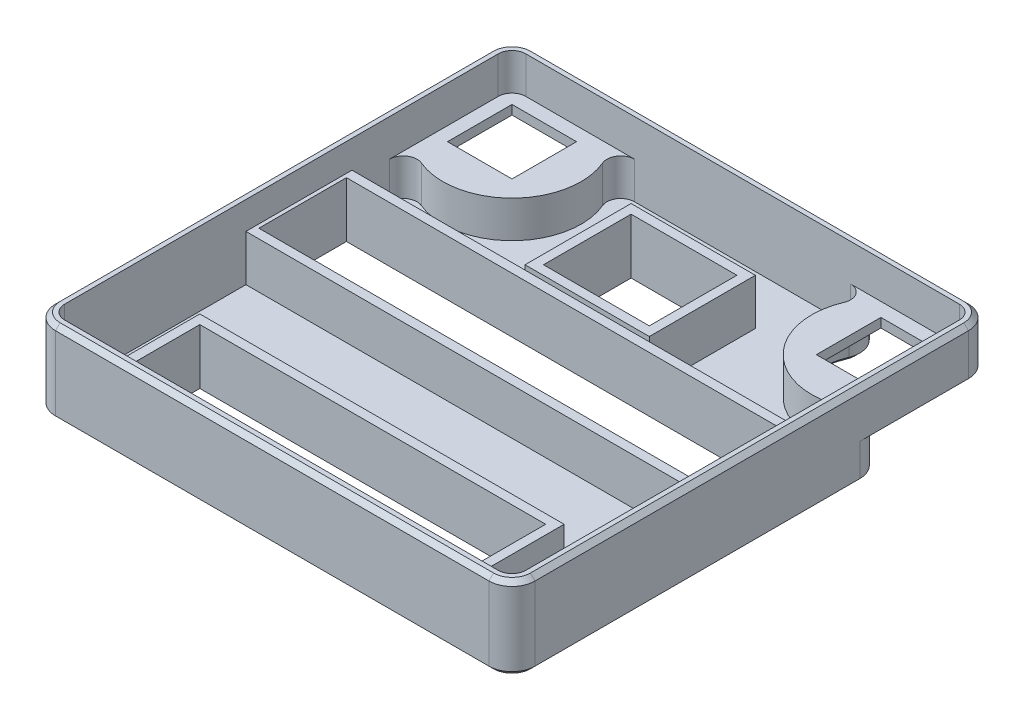
from build123d import *

# Parameters (mm, degrees)
SKETCH_1_W          = 22.95
SKETCH_1_H          = 19
SKETCH_1_W_2        = 75
SKETCH_1_W_3        = 98.4
EXTRUDE_7_DEPTH     = 2
SKETCH_4_R          = 15
CUT_EXTRUDE_1_DEPTH = 18
FILLET_1_R          = 3
FILLET_2_R          = 3
SKETCH_1_6_W        = 26.95
SKETCH_1_6_H        = 23
SKETCH_1_6_W_2      = 22.95
SKETCH_1_6_H_2      = 19
EXTRUDE_3_DEPTH     = 12
SKETCH_1_7_W        = 102.4
SKETCH_1_7_H        = 23
SKETCH_1_7_W_2      = 98.4
SKETCH_1_7_H_2      = 19
EXTRUDE_4_DEPTH     = 12
SKETCH_1_8_W        = 79
SKETCH_1_8_H        = 23
SKETCH_1_8_W_2      = 75
SKETCH_1_8_H_2      = 19
EXTRUDE_5_DEPTH     = 12
EXTRUDE_START       = 16
EXTRUDE_7_2_DEPTH   = 18
SKETCH_11_W         = 28.583123952
SKETCH_11_H         = 28.583123952
CUT_EXTRUDE_8_DEPTH = 10
EXTRUDE_START_2     = 2
SKETCH_13_W         = 14
SKETCH_13_H         = 14
EXTRUDE_8_DEPTH     = 2
SKETCH_15_W         = 14
SKETCH_15_H         = 14
EXTRUDE_9_DEPTH     = 2
EXTRUDE_START_3     = 8
EXTRUDE_12_DEPTH    = 8
CHAMFER_1_SIZE      = 1
CHAMFER_2_SIZE      = 1


with BuildPart() as part:
    # 草图1 → Extrude 7 (new body)
    with BuildSketch(Plane(origin=(0, 0, 0), x_dir=(1, 0, 0), z_dir=(0, 1, 0))):
        with BuildLine():
            Line((3, 0), (97, 0))
            ThreePointArc((97, 0), (99.121320344, 0.878679656), (100, 3))
            Line((100, 3), (100, 97))
            ThreePointArc((100, 97), (99.121320344, 99.121320344), (97, 100))
            Line((97, 100), (3, 100))
            ThreePointArc((3, 100), (0.878679656, 99.121320344), (0, 97))
            Line((0, 97), (0, 3))
            ThreePointArc((0, 3), (0.878679656, 0.878679656), (3, 0))
        make_face()
        with Locations((50, 77.8)):
            Rectangle(SKETCH_1_W, SKETCH_1_H, mode=Mode.SUBTRACT)
        with Locations((50, 10.3)):
            Rectangle(SKETCH_1_W_2, SKETCH_1_H, mode=Mode.SUBTRACT)
        with Locations((50, 53.8)):
            Rectangle(SKETCH_1_W_3, SKETCH_1_H, mode=Mode.SUBTRACT)
    extrude(amount=EXTRUDE_7_DEPTH)

    # 草图4 → 切除-拉伸1 (cut)
    with BuildSketch(Plane(origin=(0, 2, 0), x_dir=(1, 0, 0), z_dir=(0, 1, 0))):
        with Locations((10, 90)):
            Circle(SKETCH_4_R)
        with Locations((90, 90)):
            Circle(SKETCH_4_R)
    extrude(amount=-CUT_EXTRUDE_1_DEPTH, mode=Mode.SUBTRACT)

    # 圆角1
    fillet_1_edges = [part.edges().sort_by_distance(p)[0] for p in [
        (21.180339887, 1, -100),
        (0, 1, -78.819660113),
    ]]
    fillet(fillet_1_edges, radius=FILLET_1_R)

    # 圆角2
    fillet_2_edges = [part.edges().sort_by_distance(p)[0] for p in [
        (78.819660113, 1, -100),
        (100, 1, -78.819660113),
    ]]
    fillet(fillet_2_edges, radius=FILLET_2_R)

    # 草图1<6> → 拉伸-薄壁3 (add)
    with BuildSketch(Plane(origin=(0, 0, 0), x_dir=(1, 0, 0), z_dir=(0, 1, 0))):
        with Locations((50, 77.8)):
            Rectangle(SKETCH_1_6_W, SKETCH_1_6_H)
        with Locations((50, 77.8)):
            Rectangle(SKETCH_1_6_W_2, SKETCH_1_6_H_2, mode=Mode.SUBTRACT)
    extrude(amount=EXTRUDE_3_DEPTH)

    # 草图1<7> → 拉伸-薄壁4 (add)
    with BuildSketch(Plane(origin=(0, 0, 0), x_dir=(1, 0, 0), z_dir=(0, 1, 0))):
        with Locations((50, 53.8)):
            Rectangle(SKETCH_1_7_W, SKETCH_1_7_H)
        with Locations((50, 53.8)):
            Rectangle(SKETCH_1_7_W_2, SKETCH_1_7_H_2, mode=Mode.SUBTRACT)
    extrude(amount=EXTRUDE_4_DEPTH)

    # 草图1<8> → 拉伸-薄壁5 (add)
    with BuildSketch(Plane(origin=(0, 0, 0), x_dir=(1, 0, 0), z_dir=(0, 1, 0))):
        with Locations((50, 10.3)):
            Rectangle(SKETCH_1_8_W, SKETCH_1_8_H)
        with Locations((50, 10.3)):
            Rectangle(SKETCH_1_8_W_2, SKETCH_1_8_H_2, mode=Mode.SUBTRACT)
    extrude(amount=EXTRUDE_5_DEPTH)

    # 草图10 → Extrude 7 2 (add)
    with BuildSketch(Plane(origin=(0, 2, 0), x_dir=(1, 0, 0), z_dir=(0, 1, 0)).offset(EXTRUDE_START)):
        with BuildLine():
            Line((-2, 3), (-2, 73.416876048))
            ThreePointArc((-2, 73.416876048), (0.236146008, 77.583542715), (4.944444444, 78.023299368))
            ThreePointArc((4.944444444, 78.023299368), (19.192388155, 80.807611845), (21.976700632, 95.055555556))
            ThreePointArc((21.976700632, 95.055555556), (22.416457285, 99.763853992), (26.583123952, 102))
            Line((26.583123952, 102), (73.416876048, 102))
            ThreePointArc((73.416876048, 102), (77.583542715, 99.763853992), (78.023299368, 95.055555556))
            ThreePointArc((78.023299368, 95.055555556), (80.807611845, 80.807611845), (95.055555556, 78.023299368))
            ThreePointArc((95.055555556, 78.023299368), (99.763853992, 77.583542715), (102, 73.416876048))
            Line((102, 73.416876048), (102, 3))
            ThreePointArc((102, 3), (100.535533906, -0.535533906), (97, -2))
            Line((97, -2), (3, -2))
            ThreePointArc((3, -2), (-0.535533906, -0.535533906), (-2, 3))
        make_face()
        with BuildLine():
            Line((0, 3), (0, 73.416876048))
            ThreePointArc((0, 73.416876048), (1.341687605, 75.916876048), (4.166666667, 76.18073004))
            ThreePointArc((4.166666667, 76.18073004), (20.606601718, 79.393398282), (23.81926996, 95.833333333))
            ThreePointArc((23.81926996, 95.833333333), (24.083123952, 98.658312395), (26.583123952, 100))
            Line((26.583123952, 100), (73.416876048, 100))
            ThreePointArc((73.416876048, 100), (75.916876048, 98.658312395), (76.18073004, 95.833333333))
            ThreePointArc((76.18073004, 95.833333333), (79.393398282, 79.393398282), (95.833333333, 76.18073004))
            ThreePointArc((95.833333333, 76.18073004), (98.658312395, 75.916876048), (100, 73.416876048))
            Line((100, 73.416876048), (100, 3))
            ThreePointArc((100, 3), (99.121320344, 0.878679656), (97, 0))
            Line((97, 0), (3, 0))
            ThreePointArc((3, 0), (0.878679656, 0.878679656), (0, 3))
        make_face(mode=Mode.SUBTRACT)
    extrude(amount=-EXTRUDE_7_2_DEPTH)

    # 草图11 → 切除-拉伸8 (cut)
    with BuildSketch(Plane(origin=(0, 18, 0), x_dir=(1, 0, 0), z_dir=(0, 1, 0))):
        with Locations((87.708438024, 87.708438024)):
            Rectangle(SKETCH_11_W, SKETCH_11_H)
        with Locations((12.291561976, 87.708438024)):
            Rectangle(SKETCH_11_W, SKETCH_11_H)
    extrude(amount=-CUT_EXTRUDE_8_DEPTH, mode=Mode.SUBTRACT)

    # 草图13 → 凸台-拉伸8 (add)
    with BuildSketch(Plane(origin=(0, 8, 0), x_dir=(1, 0, 0), z_dir=(0, 1, 0)).offset(EXTRUDE_START_2)):
        with BuildLine():
            Line((26.583123952, 102), (26.583123952, 100))
            ThreePointArc((26.583123952, 100), (24.083123952, 98.658312395), (23.81926996, 95.833333333))
            ThreePointArc((23.81926996, 95.833333333), (20.606601718, 79.393398282), (4.166666667, 76.18073004))
            ThreePointArc((4.166666667, 76.18073004), (1.341687605, 75.916876048), (0, 73.416876048))
            Line((0, 73.416876048), (-2, 73.416876048))
            Line((-2, 73.416876048), (-2, 97))
            ThreePointArc((-2, 97), (-0.535533906, 100.535533906), (3, 102))
            Line((3, 102), (26.583123952, 102))
        make_face()
        with Locations((10, 90)):
            Rectangle(SKETCH_13_W, SKETCH_13_H, mode=Mode.SUBTRACT)
    extrude(amount=-EXTRUDE_8_DEPTH)

    # 草图15 → 凸台-拉伸9 (add)
    with BuildSketch(Plane(origin=(0, 8, 0), x_dir=(1, 0, 0), z_dir=(0, 1, 0)).offset(EXTRUDE_START_2)):
        with BuildLine():
            Line((73.416876048, 102), (97, 102))
            ThreePointArc((97, 102), (100.535533906, 100.535533906), (102, 97))
            Line((102, 97), (102, 73.416876048))
            Line((102, 73.416876048), (100, 73.416876048))
            ThreePointArc((100, 73.416876048), (98.658312395, 75.916876048), (95.833333333, 76.18073004))
            ThreePointArc((95.833333333, 76.18073004), (79.393398282, 79.393398282), (76.18073004, 95.833333333))
            ThreePointArc((76.18073004, 95.833333333), (75.916876048, 98.658312395), (73.416876048, 100))
            Line((73.416876048, 100), (73.416876048, 102))
        make_face()
        with Locations((90, 90)):
            Rectangle(SKETCH_15_W, SKETCH_15_H, mode=Mode.SUBTRACT)
    extrude(amount=-EXTRUDE_9_DEPTH)

    # 草图18 → 凸台-拉伸12 (add)
    with BuildSketch(Plane(origin=(0, 10, 0), x_dir=(1, 0, 0), z_dir=(0, 1, 0)).offset(EXTRUDE_START_3)):
        with BuildLine():
            Line((0, 73.416876048), (-2, 73.416876048))
            Line((-2, 73.416876048), (-2, 97))
            ThreePointArc((-2, 97), (-0.535533906, 100.535533906), (3, 102))
            Line((3, 102), (26.583123952, 102))
            Line((26.583123952, 102), (26.583123952, 100))
            Line((26.583123952, 100), (3, 100))
            ThreePointArc((3, 100), (0.878679656, 99.121320344), (0, 97))
            Line((0, 97), (0, 73.416876048))
        make_face()
        with BuildLine():
            Line((73.416876048, 102), (73.416876048, 100))
            Line((73.416876048, 100), (97, 100))
            ThreePointArc((97, 100), (99.121320344, 99.121320344), (100, 97))
            Line((100, 97), (100, 73.416876048))
            Line((100, 73.416876048), (102, 73.416876048))
            Line((102, 73.416876048), (102, 97))
            ThreePointArc((102, 97), (100.535533906, 100.535533906), (97, 102))
            Line((97, 102), (73.416876048, 102))
        make_face()
    extrude(amount=-EXTRUDE_12_DEPTH)

    # 倒角1
    chamfer_1_edges = [part.edges().sort_by_distance(p)[0] for p in [
        (50, 0, 2),
        (-0.535533906, 0, 0.535533906),
        (-2, 0, -38.208438024),
        (0.236146008, 0, -77.583542715),
        (22.416457285, 0, -99.763853992),
        (50, 0, -102),
        (77.583542715, 0, -99.763853992),
        (99.763853992, 0, -77.583542715),
        (102, 0, -38.208438024),
        (100.535533906, 0, 0.535533906),
        (80.807611845, 0, -80.807611845),
        (19.192388155, 0, -80.807611845),
    ]]
    chamfer(chamfer_1_edges, length=CHAMFER_1_SIZE)

    # 倒角2
    chamfer_2_edges = [part.edges().sort_by_distance(p)[0] for p in [
        (50, 18, 2),
        (100.535533906, 18, 0.535533906),
        (102, 18, -50),
        (50, 18, -102),
        (-2, 18, -50),
        (-0.535533906, 18, 0.535533906),
        (100.535533906, 18, -100.535533906),
        (-0.535533906, 18, -100.535533906),
    ]]
    chamfer(chamfer_2_edges, length=CHAMFER_2_SIZE)


solid = part.part
